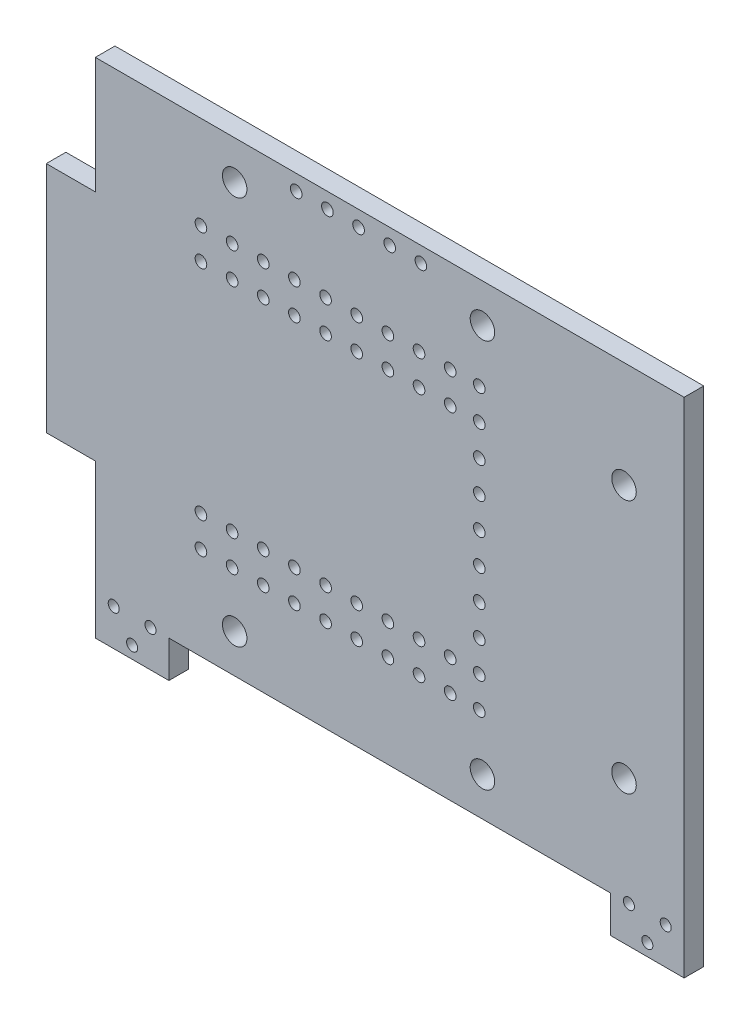
from build123d import *

# Parameters (mm, degrees)
SKETCH_1_W          = 48
SKETCH_1_H          = 38
EXTRUDE_1_DEPTH     = 1.6
SKETCH_5_R          = 1
SKETCH_5_R_2        = 0.475
CUT_EXTRUDE_1_DEPTH = 1.6
SKETCH_8_W          = 1.6
SKETCH_8_H          = 19
EXTRUDE_3_DEPTH     = 4
SKETCH_9_W          = 6
SKETCH_9_H          = 1.6
EXTRUDE_4_DEPTH     = 3
CUT_EXTRUDE_2_REACH = 37.254
SKETCH_10_R         = 0.45


with BuildPart() as part:
    # 草图1 → 凸台-拉伸1 (new body)
    with BuildSketch(Plane.XY):
        with Locations((3.5, 0)):
            Rectangle(SKETCH_1_W, SKETCH_1_H)
    extrude(amount=-EXTRUDE_1_DEPTH)

    # 草图5 → 切除-拉伸1 (cut)
    with BuildSketch(Plane.XY):
        with Locations((-9.14, 15.85)):
            Circle(SKETCH_5_R)
        with Locations((11.06, 15.85)):
            Circle(SKETCH_5_R)
        with Locations((22.6, 10.35)):
            Circle(SKETCH_5_R)
        with Locations((22.6, -10.35)):
            Circle(SKETCH_5_R)
        with Locations((-11.89, 8.89)):
            Circle(SKETCH_5_R_2)
        with Locations((-9.35, 8.89)):
            Circle(SKETCH_5_R_2)
        with Locations((-6.81, 8.89)):
            Circle(SKETCH_5_R_2)
        with Locations((-4.27, 8.89)):
            Circle(SKETCH_5_R_2)
        with Locations((-11.89, 11.43)):
            Circle(SKETCH_5_R_2)
        with Locations((-9.35, 11.43)):
            Circle(SKETCH_5_R_2)
        with Locations((-6.81, 11.43)):
            Circle(SKETCH_5_R_2)
        with Locations((-4.27, 11.43)):
            Circle(SKETCH_5_R_2)
        with Locations((-1.73, 11.43)):
            Circle(SKETCH_5_R_2)
        with Locations((0.81, 11.43)):
            Circle(SKETCH_5_R_2)
        with Locations((3.35, 11.43)):
            Circle(SKETCH_5_R_2)
        with Locations((-1.73, 8.89)):
            Circle(SKETCH_5_R_2)
        with Locations((0.81, 8.89)):
            Circle(SKETCH_5_R_2)
        with Locations((3.35, 8.89)):
            Circle(SKETCH_5_R_2)
        with Locations((5.89, 8.89)):
            Circle(SKETCH_5_R_2)
        with Locations((8.43, 8.89)):
            Circle(SKETCH_5_R_2)
        with Locations((5.89, 11.43)):
            Circle(SKETCH_5_R_2)
        with Locations((8.43, 11.43)):
            Circle(SKETCH_5_R_2)
        with Locations((10.8, 11.43)):
            Circle(SKETCH_5_R_2)
        with Locations((10.8, 8.89)):
            Circle(SKETCH_5_R_2)
        with Locations((10.8, 6.35)):
            Circle(SKETCH_5_R_2)
        with Locations((10.8, 3.81)):
            Circle(SKETCH_5_R_2)
        with Locations((10.8, 1.27)):
            Circle(SKETCH_5_R_2)
        with Locations((10.8, -1.27)):
            Circle(SKETCH_5_R_2)
        with Locations((10.8, -3.81)):
            Circle(SKETCH_5_R_2)
        with Locations((10.8, -6.35)):
            Circle(SKETCH_5_R_2)
        with Locations((-11.89, -8.89)):
            Circle(SKETCH_5_R_2)
        with Locations((-9.35, -8.89)):
            Circle(SKETCH_5_R_2)
        with Locations((-6.81, -8.89)):
            Circle(SKETCH_5_R_2)
        with Locations((-4.27, -8.89)):
            Circle(SKETCH_5_R_2)
        with Locations((-1.73, -8.89)):
            Circle(SKETCH_5_R_2)
        with Locations((0.81, -8.89)):
            Circle(SKETCH_5_R_2)
        with Locations((3.35, -8.89)):
            Circle(SKETCH_5_R_2)
        with Locations((5.89, -8.89)):
            Circle(SKETCH_5_R_2)
        with Locations((8.43, -8.89)):
            Circle(SKETCH_5_R_2)
        with Locations((10.8, -8.89)):
            Circle(SKETCH_5_R_2)
        with Locations((-11.89, -11.43)):
            Circle(SKETCH_5_R_2)
        with Locations((-9.35, -11.43)):
            Circle(SKETCH_5_R_2)
        with Locations((-6.81, -11.43)):
            Circle(SKETCH_5_R_2)
        with Locations((-4.27, -11.43)):
            Circle(SKETCH_5_R_2)
        with Locations((-1.73, -11.43)):
            Circle(SKETCH_5_R_2)
        with Locations((0.81, -11.43)):
            Circle(SKETCH_5_R_2)
        with Locations((3.35, -11.43)):
            Circle(SKETCH_5_R_2)
        with Locations((5.89, -11.43)):
            Circle(SKETCH_5_R_2)
        with Locations((8.43, -11.43)):
            Circle(SKETCH_5_R_2)
        with Locations((10.8, -11.43)):
            Circle(SKETCH_5_R_2)
        with Locations((3.5, 17.73)):
            Circle(SKETCH_5_R_2)
        with Locations((6.04, 17.73)):
            Circle(SKETCH_5_R_2)
        with Locations((0.96, 17.73)):
            Circle(SKETCH_5_R_2)
        with Locations((-4.12, 17.73)):
            Circle(SKETCH_5_R_2)
        with Locations((-1.58, 17.73)):
            Circle(SKETCH_5_R_2)
        with Locations((11.06, -15.85)):
            Circle(SKETCH_5_R)
        with Locations((-9.14, -15.85)):
            Circle(SKETCH_5_R)
    extrude(amount=-CUT_EXTRUDE_1_DEPTH, mode=Mode.SUBTRACT)

    # 草图8 → 凸台-拉伸3 (add)
    with BuildSketch(Plane.ZY.offset(20.5)):
        with Locations((-0.8, 0)):
            Rectangle(SKETCH_8_W, SKETCH_8_H)
    extrude(amount=EXTRUDE_3_DEPTH)

    # 草图9 → 凸台-拉伸4 (add)
    with BuildSketch(Plane.XZ.offset(19)):
        with Locations((-17.5, -0.8)):
            Rectangle(SKETCH_9_W, SKETCH_9_H)
        with Locations((24.5, -0.8)):
            Rectangle(SKETCH_9_W, SKETCH_9_H)
    extrude(amount=EXTRUDE_4_DEPTH)

    # 草图10 → 切除-拉伸2 (cut, up to next)
    with BuildSketch(Plane.XY, mode=Mode.PRIVATE) as cut_extrude_2_sk1:
        with Locations((-19, -19)):
            Circle(SKETCH_10_R)
    cut_extrude_2_tool1 = extrude(cut_extrude_2_sk1.sketch, amount=-CUT_EXTRUDE_2_REACH, mode=Mode.PRIVATE) & part.part
    # 草图10 → 切除-拉伸2 (cut, up to next)
    with BuildSketch(Plane.XY, mode=Mode.PRIVATE) as cut_extrude_2_sk2:
        with Locations((-16, -19)):
            Circle(SKETCH_10_R)
    cut_extrude_2_tool2 = extrude(cut_extrude_2_sk2.sketch, amount=-CUT_EXTRUDE_2_REACH, mode=Mode.PRIVATE) & part.part
    # 草图10 → 切除-拉伸2 (cut, up to next)
    with BuildSketch(Plane.XY, mode=Mode.PRIVATE) as cut_extrude_2_sk3:
        with Locations((-17.5, -21)):
            Circle(SKETCH_10_R)
    cut_extrude_2_tool3 = extrude(cut_extrude_2_sk3.sketch, amount=-CUT_EXTRUDE_2_REACH, mode=Mode.PRIVATE) & part.part
    # 草图10 → 切除-拉伸2 (cut, up to next)
    with BuildSketch(Plane.XY, mode=Mode.PRIVATE) as cut_extrude_2_sk4:
        with Locations((23, -19)):
            Circle(SKETCH_10_R)
    cut_extrude_2_tool4 = extrude(cut_extrude_2_sk4.sketch, amount=-CUT_EXTRUDE_2_REACH, mode=Mode.PRIVATE) & part.part
    # 草图10 → 切除-拉伸2 (cut, up to next)
    with BuildSketch(Plane.XY, mode=Mode.PRIVATE) as cut_extrude_2_sk5:
        with Locations((26, -19)):
            Circle(SKETCH_10_R)
    cut_extrude_2_tool5 = extrude(cut_extrude_2_sk5.sketch, amount=-CUT_EXTRUDE_2_REACH, mode=Mode.PRIVATE) & part.part
    # 草图10 → 切除-拉伸2 (cut, up to next)
    with BuildSketch(Plane.XY, mode=Mode.PRIVATE) as cut_extrude_2_sk6:
        with Locations((24.5, -21)):
            Circle(SKETCH_10_R)
    cut_extrude_2_tool6 = extrude(cut_extrude_2_sk6.sketch, amount=-CUT_EXTRUDE_2_REACH, mode=Mode.PRIVATE) & part.part
    add(cut_extrude_2_tool1.solids().sort_by_distance((-19, -19, 0))[0], mode=Mode.SUBTRACT)
    add(cut_extrude_2_tool2.solids().sort_by_distance((-16, -19, 0))[0], mode=Mode.SUBTRACT)
    add(cut_extrude_2_tool3.solids().sort_by_distance((-17.5, -21, 0))[0], mode=Mode.SUBTRACT)
    add(cut_extrude_2_tool4.solids().sort_by_distance((23, -19, 0))[0], mode=Mode.SUBTRACT)
    add(cut_extrude_2_tool5.solids().sort_by_distance((26, -19, 0))[0], mode=Mode.SUBTRACT)
    add(cut_extrude_2_tool6.solids().sort_by_distance((24.5, -21, 0))[0], mode=Mode.SUBTRACT)


solid = part.part
